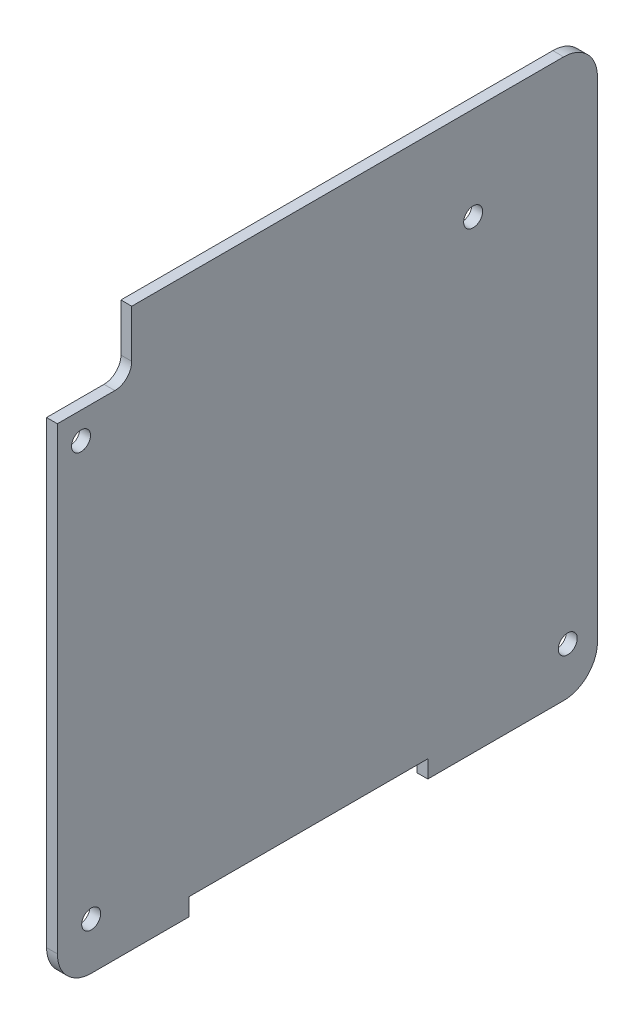
from build123d import *

# Parameters (mm, degrees)
SKETCH1_R           = 1.4
BOSS_EXTRUDE1_DEPTH = 0.8


with BuildPart() as part:
    # Sketch1 → Boss-Extrude1 (new, symmetric)
    with BuildSketch(Plane(origin=(0, 0, 0), x_dir=(0, 0, -1), z_dir=(1, 0, 0))):
        with BuildLine():
            Line((-35.297434934, -41.688153), (-20.809434934, -41.688153))
            Line((-20.809434934, -41.688153), (-20.809434934, -39.097053))
            Line((-20.809434934, -39.097053), (14.496565066, -39.097053))
            Line((14.496565066, -39.097053), (14.496565066, -41.688153))
            Line((14.496565066, -41.688153), (34.592039339, -41.688153))
            ThreePointArc((34.592039339, -41.688153), (38.127573245, -40.223686906), (39.592039339, -36.688153))
            Line((39.592039339, -36.688153), (39.592039339, 35.784769822))
            ThreePointArc((39.592039339, 35.784769822), (38.127573245, 39.320303728), (34.592039339, 40.784769822))
            Line((34.592039339, 40.784769822), (-29.297434934, 40.784769822))
            Line((-29.297434934, 40.784769822), (-29.297434934, 33.728413265))
            ThreePointArc((-29.297434934, 33.728413265), (-30.029667981, 31.960646312), (-31.797434934, 31.228413265))
            Line((-31.797434934, 31.228413265), (-40.297434934, 31.228413265))
            Line((-40.297434934, 31.228413265), (-40.297434934, -36.688153))
            ThreePointArc((-40.297434934, -36.688153), (-38.83296884, -40.223686906), (-35.297434934, -41.688153))
        make_face()
        with Locations((-36.797434934, 27.284769822)):
            Circle(SKETCH1_R, mode=Mode.SUBTRACT)
        with Locations((21.202565066, 26.984769822)):
            Circle(SKETCH1_R, mode=Mode.SUBTRACT)
        with Locations((-35.297434934, -34.715230178)):
            Circle(SKETCH1_R, mode=Mode.SUBTRACT)
        with Locations((35.202565066, -34.715230178)):
            Circle(SKETCH1_R, mode=Mode.SUBTRACT)
    extrude(amount=BOSS_EXTRUDE1_DEPTH, both=True)


solid = part.part
